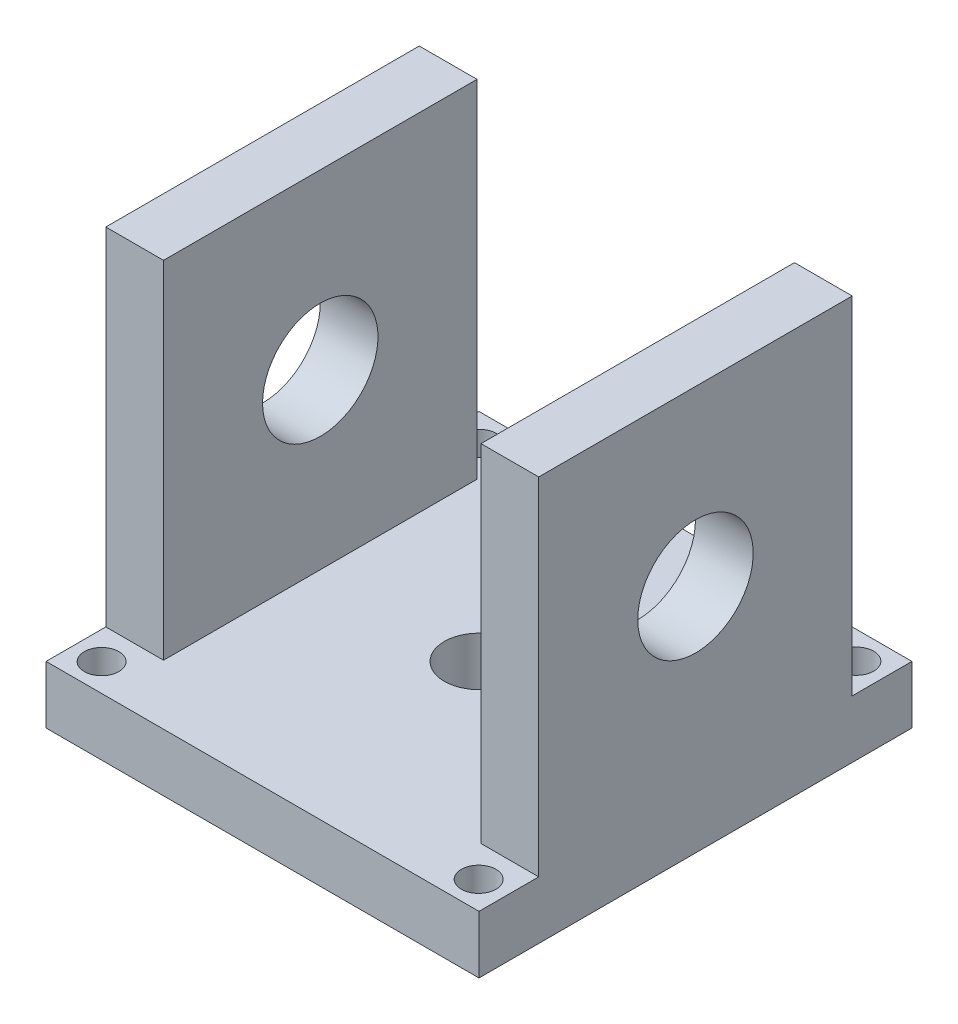
from build123d import *

# Parameters (mm, degrees)
SKETCH1_W               = 75
SKETCH1_H               = 75
SKETCH1_R               = 3
SKETCH1_R_2             = 6
BOSS_EXTRUDE1_DEPTH     = 10
SKETCH2_W               = 10
SKETCH2_H               = 54.30825561
BOSS_EXTRUDE2_DEPTH     = 60
CUT_EXTRUDE1_DEPTH      = 110.230261375
CUT_EXTRUDE1_DEPTH_BACK = 110.230261375
SKETCH3_R               = 10


with BuildPart() as part:
    # Sketch1 → Boss-Extrude1 (new body)
    with BuildSketch(Plane(origin=(0, 0, 0), x_dir=(1, 0, 0), z_dir=(0, 1, 0))):
        Rectangle(SKETCH1_W, SKETCH1_H)
        with Locations(Location((-32.66, 32.72, 0), (0, 0, 270))):
            Circle(SKETCH1_R, mode=Mode.SUBTRACT)
        with Locations(Location((32.66, 32.72, 0), (0, 0, 90))):
            Circle(SKETCH1_R, mode=Mode.SUBTRACT)
        with Locations(Location((32.66, -32.72, 0), (0, 0, 270))):
            Circle(SKETCH1_R, mode=Mode.SUBTRACT)
        with Locations(Location((-32.66, -32.72, 0), (0, 0, 90))):
            Circle(SKETCH1_R, mode=Mode.SUBTRACT)
        with Locations(Location((0, 0, 0), (0, 0, 270))):
            Circle(SKETCH1_R_2, mode=Mode.SUBTRACT)
    extrude(amount=BOSS_EXTRUDE1_DEPTH)

    # Sketch2 → Boss-Extrude2 (add)
    with BuildSketch(Plane(origin=(0, 10, 0), x_dir=(1, 0, 0), z_dir=(0, 1, 0))):
        with Locations((-32.5, 0)):
            Rectangle(SKETCH2_W, SKETCH2_H)
        with Locations((32.5, 0)):
            Rectangle(SKETCH2_W, SKETCH2_H)
    extrude(amount=BOSS_EXTRUDE2_DEPTH)

    # Sketch3 → Cut-Extrude1 (cut, two sides: drawn at the far end of the back side and taken through both)
    with BuildSketch(Plane.ZY.offset(37.5).offset(-CUT_EXTRUDE1_DEPTH_BACK)):
        with Locations((0, 40)):
            Circle(SKETCH3_R)
    extrude(amount=CUT_EXTRUDE1_DEPTH + CUT_EXTRUDE1_DEPTH_BACK, mode=Mode.SUBTRACT)


solid = part.part
